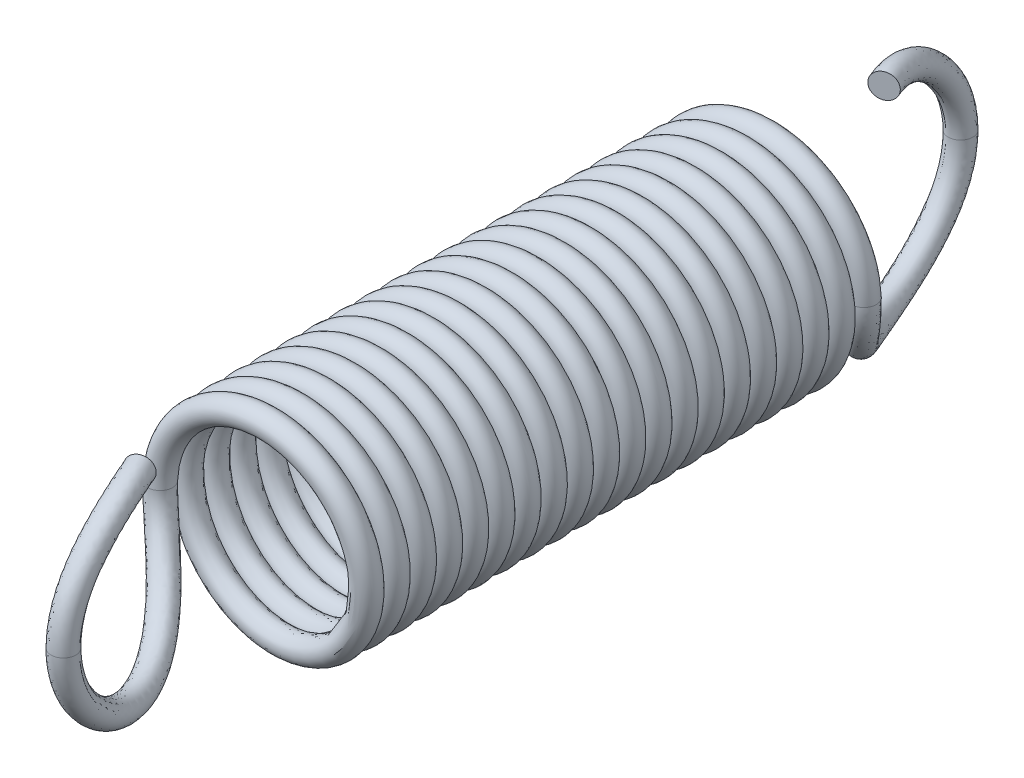
from build123d import *

# Parameters (mm, degrees)
SPRING_BODY_SWEEP_PITCH      = 2.286
SPRING_BODY_SWEEP_HEIGHT     = 44.577
SPRING_BODY_SWEEP_RADIUS     = 8.4455
SKETCH4_R                    = 1.0795
SKETCH7_R                    = 1.0795
SPRING_HOOK_CIRPATTERN_COUNT = 2


with BuildPart() as part:
    # Spring Body Sweep: sweep along a helix
    with BuildLine() as spring_body_sweep_path:
        Helix(SPRING_BODY_SWEEP_PITCH, SPRING_BODY_SWEEP_HEIGHT, SPRING_BODY_SWEEP_RADIUS, center=(0, 0, 22.2885), direction=(0, 0, -1))
    # Sketch4 → Spring Body Sweep (sweep)
    with BuildSketch(Plane(origin=(0, 0, 0), x_dir=(1, 0, 0), z_dir=(0, 1, 0))):
        with Locations((-8.4455, -22.2885)):
            Circle(SKETCH4_R)
    sweep(path=spring_body_sweep_path.line, is_frenet=True)

    # Spring Hook Sweep: sweep along a curve in space
    with BuildLine() as spring_hook_sweep_path:
        add(Edge.make_bspline(
            [(-1.762678484, 8.4455, 30.734), (-1.308906858, 8.4455, 31.773721413), (-0.944867736, 8.248902798, 32.84723021), (-0.418351719, 7.444016661, 34.868822275), (-0.251819908, 6.826255842, 35.83027027), (-0.057466372, 5.269740916, 37.427248102), (-0.024278539, 4.321740054, 38.076636081), (0.003311262, 2.249267615, 38.951818257), (0, 1.134775647, 39.1795), (0, 0, 39.1795)],
            knots=[0, 0, 0, 0, 0.25, 0.25, 0.5, 0.5, 0.75, 0.75, 1, 1, 1, 1], degree=3))
        add(Edge.make_bspline(
            [(0, 0, 39.1795), (0, -1.199860484, 39.1795), (0.004026992, -2.389036731, 38.920705447), (-0.030347926, -4.549061839, 37.947576019), (-0.07107672, -5.527487365, 37.229328737), (-0.312739895, -7.10699912, 35.449185626), (-0.515251652, -7.690905497, 34.406598839), (-1.145643662, -8.391211844, 32.225835574), (-1.569455703, -8.504921313, 31.104246273), (-2.593550546, -8.328650259, 28.972082376), (-3.191149459, -8.040955272, 27.964204046), (-4.454759215, -7.170543796, 26.161032366), (-5.12699685, -6.585923741, 25.355130606), (-6.430490444, -5.163384076, 23.97781081), (-7.070420503, -4.322539881, 23.399332136), (-8.086715125, -2.347612015, 22.550454221), (-8.4455, -1.205113344, 22.2885), (-8.4455, 0, 22.2885)],
            knots=[0, 0, 0, 0, 0.125, 0.125, 0.25, 0.25, 0.375, 0.375, 0.5, 0.5, 0.625, 0.625, 0.75, 0.75, 0.875, 0.875, 1, 1, 1, 1], degree=3))
    # Sketch7 → Spring Hook Sweep (sweep)
    with BuildSketch(Plane.XZ):
        with Locations((-8.4455, 22.2885)):
            Circle(SKETCH7_R)
    spring_hook_sweep = sweep(path=spring_hook_sweep_path.line)

    # Spring Hook CirPattern: Spring Hook Sweep ×2 about axis
    spring_hook_cirpattern_axis = Axis((0, 7.560557157, 0), (0, -1, 0))
    for i in range(1, SPRING_HOOK_CIRPATTERN_COUNT):
        add(spring_hook_sweep.rotate(spring_hook_cirpattern_axis, i * 360 / SPRING_HOOK_CIRPATTERN_COUNT))


solid = part.part
